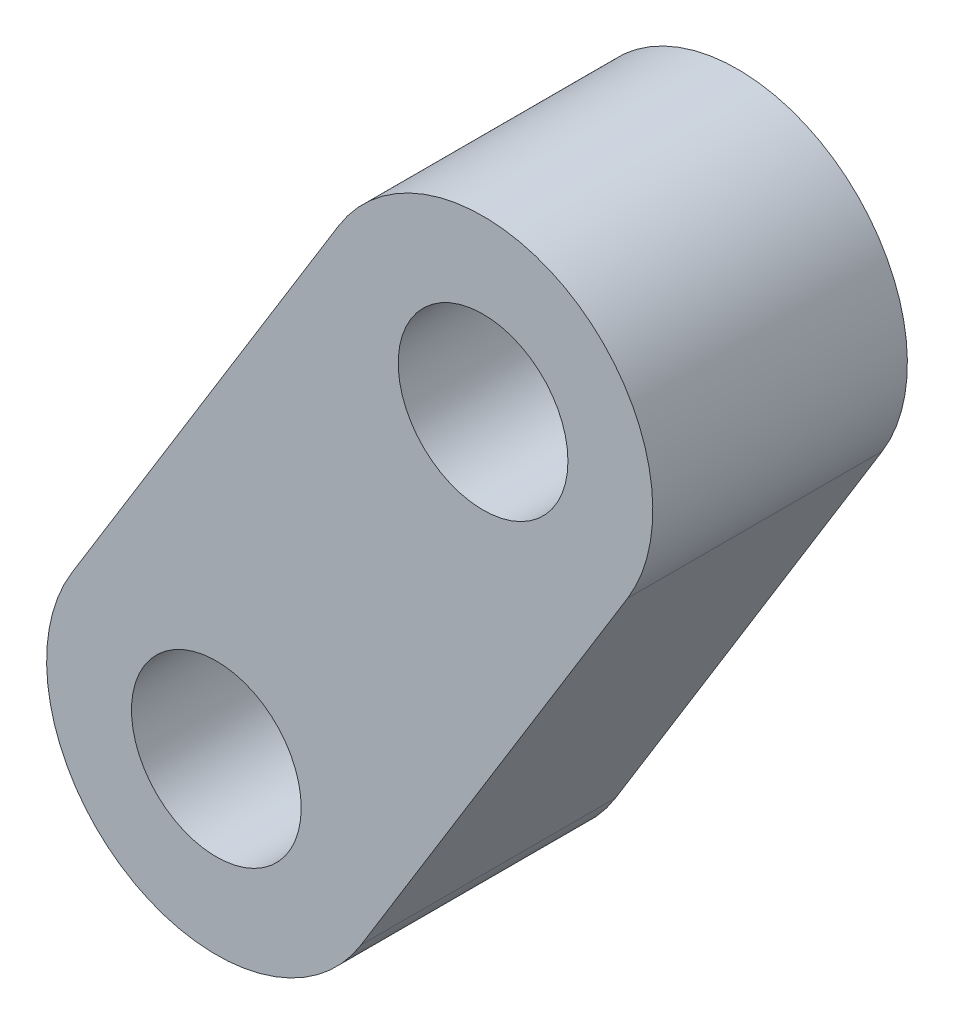
from build123d import *

# Parameters (mm, degrees)
SKETCH1_R           = 1
BOSS_EXTRUDE1_DEPTH = 3


with BuildPart() as part:
    # Sketch1 → Boss-Extrude1 (new body)
    with BuildSketch(Plane.XY):
        with BuildLine():
            Line((-0.87687933, -5.299253963), (2.266189872, -0.188371849))
            ThreePointArc((2.266189872, -0.188371849), (5.017506978, 0.467565789), (5.673444616, -2.283751317))
            Line((5.673444616, -2.283751317), (2.530375413, -7.394633431))
            ThreePointArc((2.530375413, -7.394633431), (-0.220941692, -8.050571069), (-0.87687933, -5.299253963))
        make_face()
        with Locations((0.826748042, -6.346943697)):
            Circle(SKETCH1_R, mode=Mode.SUBTRACT)
        with Locations((3.969817244, -1.236061583)):
            Circle(SKETCH1_R, mode=Mode.SUBTRACT)
    extrude(amount=BOSS_EXTRUDE1_DEPTH)


solid = part.part
